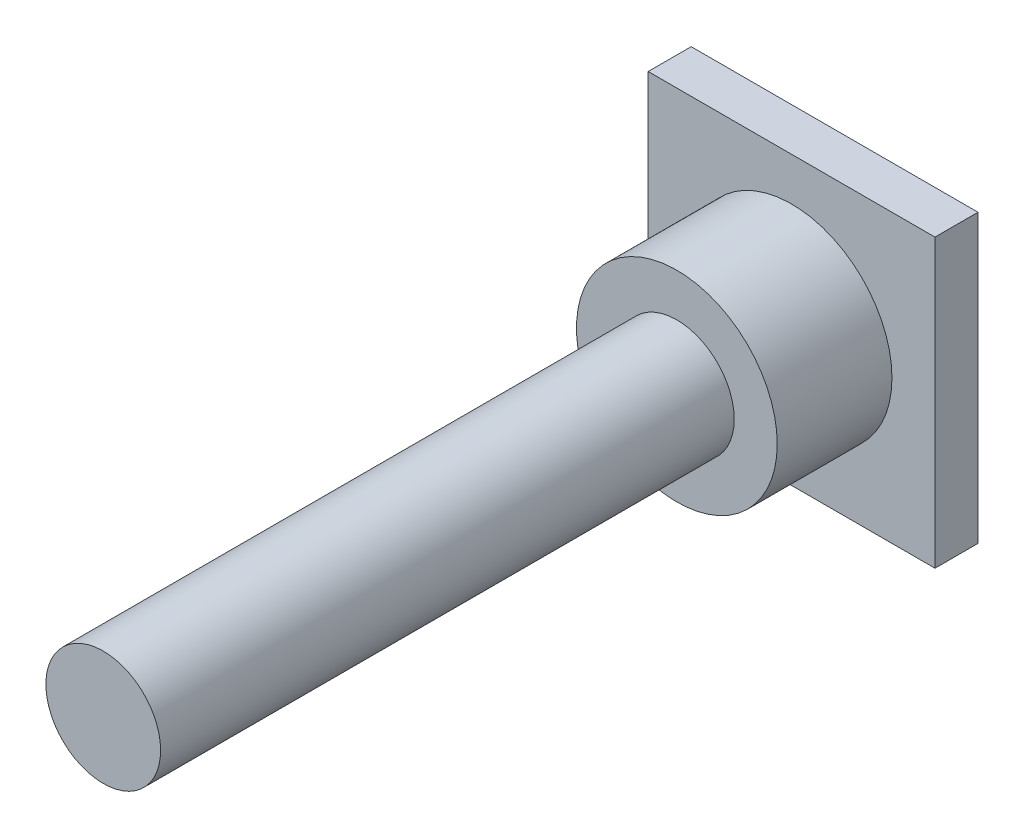
from build123d import *

# Parameters (mm, degrees)
F_1_BASE_W               = 100
F_1_BASE_H               = 100
RESSALTO_EXTRUS_O1_DEPTH = 15
F_2_BASE_EIXO_R          = 35
RESSALTO_EXTRUS_O2_DEPTH = 40
ESBO_O3_R                = 20
RESSALTO_EXTRUS_O3_DEPTH = 200


with BuildPart() as part:
    # 1_Base → Ressalto-extrusão1 (new body)
    with BuildSketch(Plane(origin=(0, 0, 0), x_dir=(0, 1, 0), z_dir=(0, 0, 1))):
        Rectangle(F_1_BASE_W, F_1_BASE_H)
    extrude(amount=RESSALTO_EXTRUS_O1_DEPTH)

    # 2_Base_eixo → Ressalto-extrusão2 (add)
    with BuildSketch(Plane.XY.offset(15)):
        Circle(F_2_BASE_EIXO_R)
    extrude(amount=RESSALTO_EXTRUS_O2_DEPTH)

    # Esboço3 → Ressalto-extrusão3 (add)
    with BuildSketch(Plane.XY.offset(55)):
        Circle(ESBO_O3_R)
    extrude(amount=RESSALTO_EXTRUS_O3_DEPTH)


solid = part.part
